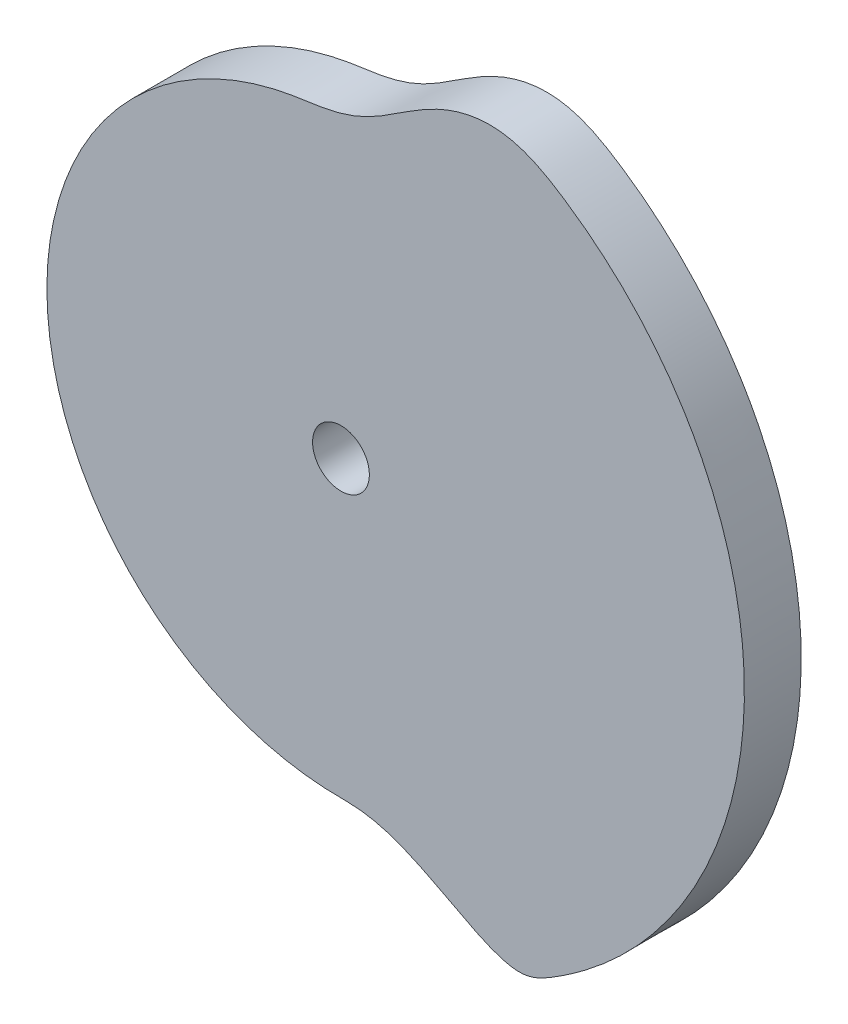
from build123d import *

# Parameters (mm, degrees)
EXTRUDE_1_DEPTH     = 20
SKETCH_3_R          = 10
CUT_EXTRUDE_1_DEPTH = 20


with BuildPart() as part:
    # 草图2 → 凸台-拉伸1 (new body)
    with BuildSketch(Plane.XY):
        with BuildLine():
            add(Edge.make_bspline(
                [(120.6409, 74.9228), (120.424491644, 75.271253162), (119.987025383, 75.968711121), (119.321122278, 77.010451791), (118.644596159, 78.048812713), (117.95902515, 79.08120058), (117.264349113, 80.107516561), (116.560918235, 81.127821325), (115.848463484, 82.141875173), (115.127135969, 83.149607476), (114.397261787, 84.15119926), (113.658547071, 85.146290185), (112.91113699, 86.13485764), (112.155219415, 87.116929117), (111.390710021, 88.092322615), (110.617708202, 89.061021481), (109.836281751, 90.02296082), (109.046499787, 90.978014766), (108.248479663, 91.926187723), (107.442137758, 92.867285497), (106.627672518, 93.801382472), (105.805035306, 94.728312903), (104.974339947, 95.648017536), (104.135636049, 96.560383125), (103.289071135, 97.465482103), (102.434635925, 98.363146423), (101.572267486, 99.253246828), (100.702307596, 100.135852531), (99.824632858, 101.010811334), (98.939374295, 101.878086521), (98.046535597, 102.737579182), (97.146334041, 103.589348102), (96.238635721, 104.43311522), (95.323570878, 105.268946887), (94.401342388, 106.096822722), (93.471865757, 106.9165788), (92.535282406, 107.728159928), (91.591644379, 108.531547539), (90.641169726, 109.326824782), (89.683640319, 110.113583545), (88.71930387, 110.892012571), (87.748251038, 111.662040731), (86.770355473, 112.423374706), (85.786113587, 113.176470761), (84.795174076, 113.920754444), (83.797764829, 114.656330372), (82.794053348, 115.383260732), (81.784050339, 116.101406075), (80.767696792, 116.810549085), (79.745332856, 117.511018129), (78.716802071, 118.202358007), (77.684613003, 118.883395625), (76.653017798, 119.550902872), (75.625782791, 120.201031454), (74.603872822, 120.830554503), (73.586619262, 121.438667081), (72.572958175, 122.024099165), (71.561999561, 122.585769837), (70.55292245, 123.1229207), (69.544884738, 123.634685536), (68.53686813, 124.120039815), (67.528375595, 124.578816462), (66.518335228, 125.009937131), (65.506083846, 125.413008412), (64.490834361, 125.787601607), (63.471842078, 126.133191003), (62.448327159, 126.449174898), (61.419694057, 126.73534941), (60.385355286, 126.991369432), (59.344684974, 127.216403094), (58.29732369, 127.410482462), (57.242873686, 127.573127971), (56.181092346, 127.703799145), (55.111827958, 127.802125229), (54.035125131, 127.867843024), (52.951079132, 127.900487581), (51.859972615, 127.899891561), (50.76222517, 127.865999284), (49.658408678, 127.798058415), (48.54917794, 127.696732555), (47.435331722, 127.561398714), (46.317738848, 127.392729508), (45.197445982, 127.190497265), (44.075418826, 126.955471198), (42.95279176, 126.687943953), (41.830772274, 126.388443588), (40.71042266, 126.058009772), (39.592907794, 125.697355651), (38.479251351, 125.307628523), (37.370563758, 124.889877701), (36.267753196, 124.445490131), (35.171826674, 123.975577346), (34.083309091, 123.482128916), (33.00307387, 122.966169583), (31.931537491, 122.429506124), (30.868929351, 121.873966938), (29.815549537, 121.301125779), (28.771312385, 120.712840739), (27.736142877, 120.110768316), (26.709730739, 119.496620565), (25.691342823, 118.872541261), (24.680577714, 118.239837179), (23.676270422, 117.60054452), (22.677557518, 116.95627162), (21.683055234, 116.308909767), (20.691654753, 115.659921727), (19.701643253, 115.011306861), (18.711711778, 114.364443525), (17.720156292, 113.721261438), (16.725303592, 113.083524634), (15.725581844, 112.453029714), (14.719568632, 111.831558346), (13.705762259, 111.221129856), (12.683079376, 110.623682527), (11.6506221, 110.04098993), (10.607593363, 109.475496889), (9.553866502, 108.928897174), (8.489494478, 108.403285947), (7.415065362, 107.900271443), (6.331393606, 107.421598385), (5.239802657, 106.968399135), (4.141791836, 106.541813064), (3.039231258, 106.142219279), (1.934038816, 105.769985071), (0.828229923, 105.424902541), (-0.276080933, 105.106107748), (-1.377085582, 104.812768364), (-2.472843884, 104.543340058), (-3.561741763, 104.296290192), (-4.642243091, 104.06995509), (-5.713006031, 103.861934663), (-6.772903126, 103.670248938), (-7.820877185, 103.492803552), (-8.855980589, 103.327312827), (-9.877336984, 103.171685571), (-10.884169037, 103.023645404), (-11.87563122, 102.881019759), (-12.850963337, 102.742276536), (-13.809212945, 102.604942503), (-14.749601761, 102.467757589), (-15.671168958, 102.328673645), (-16.57629173, 102.185952568), (-17.470623157, 102.0367669), (-18.360405304, 101.880515445), (-19.248772566, 101.716404218), (-20.13564812, 101.544440333), (-21.021048463, 101.365031996), (-21.904796436, 101.177665093), (-22.786900748, 100.982678239), (-23.667276148, 100.780005131), (-24.545821381, 100.569541913), (-25.422515028, 100.351608438), (-26.297257766, 100.12583966), (-27.170007245, 99.892592762), (-28.040697517, 99.651647908), (-28.909224533, 99.403153155), (-29.775625473, 99.147191522), (-30.639645448, 98.883429117), (-31.501398295, 98.612352437), (-32.360749974, 98.333764474), (-33.217615572, 98.047519299), (-34.071997105, 97.753955472), (-34.923772353, 97.452936638), (-35.772836983, 97.144453649), (-36.619169957, 96.82848923), (-37.462777389, 96.505353739), (-38.30348451, 96.174709858), (-39.141314725, 95.836794663), (-39.976180164, 95.491661247), (-40.807926887, 95.139059868), (-41.636647526, 94.779441059), (-42.46211951, 94.412360002), (-43.28443952, 94.038334765), (-44.103407036, 93.656953744), (-44.919011076, 93.268519186), (-45.73122035, 92.872927633), (-46.539980013, 92.470435974), (-47.345089439, 92.060614341), (-48.146712262, 91.644080784), (-48.94462083, 91.220484028), (-49.738739178, 90.789817959), (-50.529144727, 90.352377143), (-51.315649831, 89.907891412), (-52.098367795, 89.456793432), (-52.876952735, 88.998608541), (-53.651583059, 88.533794908), (-54.422212961, 88.062352462), (-55.18857334, 87.583990303), (-55.950826305, 87.099128779), (-56.708723427, 86.607493212), (-57.462325514, 86.109268511), (-58.211621817, 85.604601327), (-58.956484078, 85.093396256), (-59.696704612, 84.57557028), (-60.432514053, 84.051451962), (-61.163653329, 83.520867802), (-61.890179062, 82.983945609), (-62.61204334, 82.440739775), (-63.329046631, 81.891144381), (-64.041349598, 81.335453387), (-64.748602189, 80.773404637), (-65.451035593, 80.205333037), (-66.148419235, 79.631092769), (-66.840871801, 79.050908786), (-67.528161538, 78.464614647), (-68.210257816, 77.872253469), (-68.887282692, 77.274105354), (-69.558964677, 76.669966936), (-70.225394501, 76.060085059), (-70.886420603, 75.444326452), (-71.542075219, 74.822866328), (-72.192335206, 74.19574541), (-72.837021284, 73.562915433), (-73.476247064, 72.924526123), (-74.109836969, 72.280533369), (-74.737732728, 71.631014726), (-75.359954504, 70.976088579), (-75.976480968, 70.315797143), (-76.587168498, 69.650072213), (-77.192067873, 68.979089065), (-77.791083449, 68.302857213), (-78.384212585, 67.621465693), (-78.971299121, 66.934841874), (-79.552398543, 66.243158006), (-80.127449529, 65.546394454), (-80.696379974, 64.844648429), (-81.259271304, 64.138010166), (-81.815796066, 63.426433309), (-82.366183043, 62.710064654), (-82.910242858, 61.988883007), (-83.4480472, 61.263001612), (-83.979482382, 60.532427296), (-84.504567771, 59.797288746), (-85.023143755, 59.057563535), (-85.535342114, 58.313422249), (-86.040845555, 57.564715903), (-86.540049346, 56.811753825), (-87.032353612, 56.054273907), (-87.518336475, 55.292750342), (-87.99741782, 54.526855333), (-88.469882689, 53.756882285), (-88.935806824, 52.982888952), (-89.39455478, 52.204653291), (-89.846880018, 51.422659011), (-90.292164182, 50.636642103), (-90.730495972, 49.846714448), (-91.162217922, 49.053162123), (-91.586623663, 48.255652742), (-92.004388931, 47.454634351), (-92.41496606, 46.649916188), (-92.818465649, 45.841661442), (-93.215009309, 45.029960729), (-93.604359954, 44.214765855), (-93.986708352, 43.396266158), (-94.361790125, 42.574404793), (-94.729797784, 41.749367284), (-95.090536679, 40.921112368), (-95.443888237, 40.089706841), (-95.790103363, 39.255276993), (-96.129128923, 38.417910625), (-96.460742048, 37.577577926), (-96.7849133, 36.734350598), (-97.101825611, 35.888364913), (-97.41136101, 35.03965274), (-97.713329519, 34.188226244), (-98.007927599, 33.334223249), (-98.295151321, 32.477706483), (-98.574876711, 31.618721887), (-98.846927767, 30.757249485), (-99.111664487, 29.893512443), (-99.368761821, 29.027475226), (-99.618271779, 28.159242254), (-99.860183021, 27.28884247), (-100.094407886, 26.416345572), (-100.321350782, 25.541906032), (-100.540241135, 24.665425405), (-100.751659446, 23.787095867), (-100.955513949, 22.907021367), (-101.151460201, 22.025125963), (-101.339902065, 21.141614206), (-101.520486179, 20.256435191), (-101.69336926, 19.369764188), (-101.858617162, 18.481610876), (-102.01599017, 17.592037407), (-102.165610823, 16.701105737), (-102.30737402, 15.808893366), (-102.441496244, 14.915500993), (-102.567830439, 14.020975092), (-102.686182442, 13.125396071), (-102.796819275, 12.228799489), (-102.899577679, 11.331293825), (-102.994639575, 10.432902461), (-103.081681111, 9.533725625), (-103.161035713, 8.633798881), (-103.232380716, 7.733224067), (-103.29602957, 6.832062336), (-103.351709809, 5.930392903), (-103.399525951, 5.028259015), (-103.439387105, 4.125755015), (-103.471525472, 3.222923514), (-103.495714092, 2.319855105), (-103.51201456, 1.416620728), (-103.520427137, 0.513286022), (-103.520877571, -0.390114453), (-103.5136626, -1.293483762), (-103.498274495, -2.196749103), (-103.475236409, -3.099852243), (-103.444177876, -4.002716524), (-103.405459397, -4.905290952), (-103.358578231, -5.807451426), (-103.304034091, -6.709190954), (-103.24148294, -7.610419605), (-103.171222296, -8.511092641), (-103.093037465, -9.411096242), (-103.006843618, -10.310347785), (-102.9131718, -11.208873106), (-102.811252368, -12.106516504), (-102.701841347, -13.003269647), (-102.584383521, -13.89899303), (-102.45921027, -14.793664536), (-102.326197334, -15.687197538), (-102.185402039, -16.579533268), (-102.036769479, -17.470623438), (-101.880514754, -18.360405229), (-101.716404403, -19.248772586), (-101.544440283, -20.135648115), (-101.36503201, -21.021048464), (-101.177665089, -21.904796435), (-100.98267824, -22.786900748), (-100.780005131, -23.667276148), (-100.569541913, -24.545821381), (-100.351608438, -25.422515028), (-100.12583966, -26.297257766), (-99.892592762, -27.170007245), (-99.651647908, -28.040697517), (-99.403153155, -28.909224533), (-99.147191522, -29.775625473), (-98.883429117, -30.639645448), (-98.612352437, -31.501398295), (-98.333764474, -32.360749974), (-98.047519299, -33.217615572), (-97.753955472, -34.071997105), (-97.452936638, -34.923772353), (-97.144453649, -35.772836983), (-96.82848923, -36.619169957), (-96.505353739, -37.462777389), (-96.174709858, -38.30348451), (-95.836794663, -39.141314725), (-95.491661247, -39.976180164), (-95.139059868, -40.807926887), (-94.779441059, -41.636647526), (-94.412360002, -42.46211951), (-94.038334765, -43.28443952), (-93.656953744, -44.103407036), (-93.268519186, -44.919011076), (-92.872927633, -45.73122035), (-92.470435974, -46.539980013), (-92.060614341, -47.345089439), (-91.644080784, -48.146712262), (-91.220484028, -48.94462083), (-90.789817959, -49.738739178), (-90.352377143, -50.529144727), (-89.907891412, -51.315649831), (-89.456793432, -52.098367795), (-88.998608541, -52.876952735), (-88.533794908, -53.651583059), (-88.062352462, -54.422212961), (-87.583990303, -55.18857334), (-87.099128779, -55.950826305), (-86.607493212, -56.708723427), (-86.109268511, -57.462325514), (-85.604601327, -58.211621817), (-85.093396256, -58.956484078), (-84.57557028, -59.696704612), (-84.051451962, -60.432514053), (-83.520867802, -61.163653329), (-82.983945609, -61.890179062), (-82.440739775, -62.61204334), (-81.891144381, -63.329046631), (-81.335453387, -64.041349598), (-80.773404637, -64.748602189), (-80.205333037, -65.451035593), (-79.631092769, -66.148419235), (-79.050908786, -66.840871801), (-78.464614647, -67.528161538), (-77.872253469, -68.210257816), (-77.274105354, -68.887282692), (-76.669966936, -69.558964677), (-76.060085059, -70.225394501), (-75.444326452, -70.886420603), (-74.822866328, -71.542075219), (-74.19574541, -72.192335206), (-73.562915433, -72.837021284), (-72.924526123, -73.476247064), (-72.280533369, -74.109836969), (-71.631014726, -74.737732728), (-70.976088579, -75.359954504), (-70.315797143, -75.976480968), (-69.650072213, -76.587168498), (-68.979089065, -77.192067873), (-68.302857213, -77.791083449), (-67.621465693, -78.384212585), (-66.934841874, -78.971299121), (-66.243158006, -79.552398543), (-65.546394454, -80.127449529), (-64.844648429, -80.696379974), (-64.138010166, -81.259271304), (-63.426433309, -81.815796066), (-62.710064654, -82.366183043), (-61.988883007, -82.910242858), (-61.263001612, -83.4480472), (-60.532427296, -83.979482382), (-59.797288746, -84.504567771), (-59.057563535, -85.023143755), (-58.313422249, -85.535342114), (-57.564715903, -86.040845555), (-56.811753825, -86.540049346), (-56.054273907, -87.032353612), (-55.292750342, -87.518336475), (-54.526855333, -87.99741782), (-53.756882285, -88.469882689), (-52.982888952, -88.935806824), (-52.204653291, -89.39455478), (-51.422659011, -89.846880018), (-50.636642103, -90.292164182), (-49.846714448, -90.730495972), (-49.053162123, -91.162217922), (-48.255652742, -91.586623663), (-47.454634351, -92.004388931), (-46.649916188, -92.41496606), (-45.841661442, -92.818465649), (-45.029960729, -93.215009309), (-44.214765855, -93.604359954), (-43.396266158, -93.986708352), (-42.574404793, -94.361790125), (-41.749367284, -94.729797784), (-40.921112368, -95.090536679), (-40.089706841, -95.443888237), (-39.255276993, -95.790103363), (-38.417910625, -96.129128923), (-37.577577926, -96.460742048), (-36.734350598, -96.7849133), (-35.888364913, -97.101825611), (-35.03965274, -97.41136101), (-34.188226244, -97.713329519), (-33.334223249, -98.007927599), (-32.477706483, -98.295151321), (-31.618721887, -98.574876711), (-30.757249485, -98.846927767), (-29.893512443, -99.111664487), (-29.027475226, -99.368761821), (-28.159242254, -99.618271779), (-27.28884247, -99.860183021), (-26.416345572, -100.094407886), (-25.541906032, -100.321350782), (-24.665425405, -100.540241135), (-23.787095867, -100.751659446), (-22.907021367, -100.955513949), (-22.025125963, -101.151460201), (-21.141614206, -101.339902065), (-20.256435191, -101.520486179), (-19.369764188, -101.69336926), (-18.481610876, -101.858617162), (-17.592037407, -102.01599017), (-16.701105737, -102.165610823), (-15.808893366, -102.30737402), (-14.915500993, -102.441496244), (-14.020975092, -102.567830439), (-13.125396071, -102.686182442), (-12.228799489, -102.796819275), (-11.331293825, -102.899577679), (-10.432902461, -102.994639575), (-9.533725625, -103.081681111), (-8.633798881, -103.161035713), (-7.733224067, -103.232380716), (-6.832062335, -103.29602957), (-5.930392905, -103.351709807), (-5.028259007, -103.399525958), (-4.125755044, -103.439387079), (-3.222923409, -103.471525567), (-2.319788866, -103.495715521), (-1.405150595, -103.512222578), (-0.456406908, -103.520875998), (0.54905491, -103.528252427), (1.622163909, -103.54085635), (2.761350056, -103.566087551), (3.963382766, -103.612131975), (5.223690223, -103.686432441), (6.536603571, -103.796227305), (7.895779989, -103.947992278), (9.294748702, -104.146174913), (10.727233992, -104.394687904), (12.187886562, -104.695164427), (13.672167772, -105.048828152), (15.176778809, -105.455122458), (16.699242686, -105.913454993), (18.23815877, -106.422067087), (19.792540448, -106.979304502), (21.361821663, -107.58299346), (22.945579427, -108.230442758), (24.543258829, -108.91892615), (26.154028298, -109.645212552), (27.776541232, -110.406101608), (29.409414301, -111.197248645), (31.050486831, -112.014580426), (32.697261397, -112.853271038), (34.346796519, -113.708151348), (35.995937881, -114.573266469), (37.640924143, -115.443106468), (39.277932922, -116.311085729), (40.902932078, -117.170599291), (42.511437603, -118.015035764), (44.099185033, -118.837467148), (45.661602062, -119.631174133), (47.194264219, -120.389344747), (48.69243131, -121.10593065), (50.151649024, -121.7750668), (51.567711177, -122.391148586), (52.936264615, -122.950201334), (54.253583756, -123.448404235), (55.516336238, -123.883447921), (56.721838339, -124.254215941), (57.868494215, -124.560531943), (58.955720542, -124.804160301), (59.984715006, -124.987134211), (60.958277943, -125.112570797), (61.881012249, -125.184652236), (62.759457157, -125.206404854), (63.601678642, -125.181409946), (64.416911647, -125.111756615), (65.21500676, -124.998848228), (66.005622242, -124.842165588), (66.797936737, -124.641163889), (67.599983666, -124.394064432), (68.418401746, -124.098749126), (69.258502296, -123.753572551), (70.124371814, -123.357462606), (71.019101562, -122.910126488), (71.945056514, -122.412038523), (72.904534356, -121.865296273), (73.899333807, -121.272435061), (74.924108451, -120.642144242), (75.966311085, -119.988579265), (77.010449535, -119.321118434), (78.048813317, -118.644597189), (79.081200418, -117.959024874), (80.107516605, -117.264349187), (81.127821313, -116.560918216), (82.141875177, -115.848463489), (83.149607475, -115.127135967), (84.15119926, -114.397261788), (85.146290185, -113.65854707), (86.13485764, -112.91113699), (87.116929117, -112.155219415), (88.092322615, -111.390710021), (89.061021481, -110.617708202), (90.02296082, -109.836281751), (90.978014766, -109.046499787), (91.926187723, -108.248479663), (92.867285497, -107.442137758), (93.801382472, -106.627672518), (94.728312903, -105.805035306), (95.648017536, -104.974339947), (96.560383125, -104.135636049), (97.465482103, -103.289071135), (98.363146423, -102.434635925), (99.253246828, -101.572267486), (100.135852531, -100.702307596), (101.010811334, -99.824632858), (101.878086521, -98.939374295), (102.737579182, -98.046535597), (103.589348102, -97.146334041), (104.43311522, -96.238635721), (105.268946887, -95.323570878), (106.096822722, -94.401342388), (106.9165788, -93.471865757), (107.728159928, -92.535282406), (108.531547539, -91.591644379), (109.326824782, -90.641169726), (110.113583545, -89.683640319), (110.892012571, -88.71930387), (111.662040731, -87.748251038), (112.423374707, -86.770355474), (113.176470758, -85.786113586), (113.920754454, -84.795174083), (114.656330335, -83.797764804), (115.383260872, -82.794053439), (116.101405555, -81.784049996), (116.810551027, -80.767698073), (117.511010884, -79.745328077), (118.20240057, -78.716796812), (118.8847958, -77.682271159), (119.558222817, -76.641908702), (120.222424187, -75.595632333), (120.877551892, -74.543648038), (121.523398157, -73.485927349), (122.160197639, -72.422738205), (122.787428996, -71.353889812), (123.405492736, -70.279691553), (124.014039759, -69.200074372), (124.613302973, -68.115292296), (125.202911256, -67.025223867), (125.782945843, -65.930037005), (126.353647945, -64.829937916), (126.914470494, -63.724795337), (127.465852214, -62.614916422), (128.007310178, -61.500160109), (128.539141179, -60.380772117), (129.061127279, -59.256746923), (129.573344513, -58.128251621), (130.075666447, -56.995309298), (130.568033704, -55.858010729), (131.050579408, -54.716493092), (131.523068003, -53.570770373), (131.985560431, -52.420996809), (132.438014377, -51.26723324), (132.88024373, -50.109510371), (133.312634042, -48.948064033), (133.734560515, -47.782795932), (134.146514639, -46.613977613), (134.548222271, -45.441574532), (134.939609169, -44.265686666), (135.320694022, -43.086422055), (135.69164115, -41.903941889), (136.052137326, -40.718223822), (136.402201895, -39.529388263), (136.742059509, -38.33760805), (137.071341799, -37.142844348), (137.390216148, -35.945256264), (137.69878233, -34.744974564), (137.996617105, -33.541993265), (138.284183661, -32.336510246), (138.561058742, -31.128521853), (138.827345124, -29.918163612), (139.083173898, -28.705562116), (139.328367999, -27.490745908), (139.56295893, -26.273829853), (139.786997563, -25.054928066), (140.00024355, -23.834098499), (140.203023167, -22.611507907), (140.39485261, -21.387138301), (140.576192301, -20.161168693), (140.746769137, -18.933651298), (140.906719186, -17.704714219), (141.055762856, -16.474422403), (141.194219032, -15.242884964), (141.321769035, -14.010162236), (141.438712632, -12.776388957), (141.544769468, -11.541601923), (141.640229018, -10.30596433), (141.724702177, -9.069511895), (141.798359735, -7.832427757), (141.861448943, -6.59475481), (141.913452989, -5.356567445), (141.954940991, -4.117925673), (141.985387695, -2.878975655), (142.005103708, -1.639795755), (142.013998563, -0.400548564), (142.012101276, 0.838765169), (141.999394635, 2.07797874), (141.975923493, 3.317094113), (141.941505279, 4.555907218), (141.896264978, 5.79438423), (141.840432566, 7.032404119), (141.773599019, 8.269915329), (141.695968238, 9.506791038), (141.607737199, 10.742981719), (141.508465076, 11.978318125), (141.398617309, 13.212772848), (141.277866665, 14.446178625), (141.146517167, 15.678501668), (141.004265646, 16.909606043), (140.851425299, 18.139432152), (140.687633935, 19.367858431), (140.513421509, 20.594860981), (140.328284823, 21.820265885), (140.132450515, 23.044002167), (139.92610128, 24.26599751), (139.708957524, 25.486131995), (139.481255558, 26.704345542), (139.243009107, 27.920544688), (138.99393061, 29.134563234), (138.734470287, 30.346393126), (138.464378035, 31.555910835), (138.18361069, 32.762994065), (137.892595114, 33.967645837), (137.59080091, 35.169654288), (137.278777375, 36.369031119), (136.956146522, 37.565606185), (136.622996665, 38.759288722), (136.279650837, 39.95009592), (135.925826103, 41.137838368), (135.561617137, 42.322441509), (135.187101686, 43.503808092), (134.802450156, 44.681895881), (134.407268318, 45.856496103), (134.002016633, 47.027695649), (133.586477605, 48.195286377), (133.160919152, 49.359230752), (132.72506169, 50.519347308), (132.279207826, 51.675649139), (131.823132684, 52.82799017), (131.357191608, 53.976364561), (130.881161767, 55.120603756), (130.395148685, 56.260649712), (129.899165204, 57.396379439), (129.393318608, 58.527742903), (128.877742537, 59.654687565), (128.352228772, 60.777085004), (127.816914824, 61.894831324), (127.272038529, 63.00792822), (126.717288869, 64.116140244), (126.15292268, 65.21947613), (125.578961934, 66.317881334), (124.995502626, 67.411238642), (124.40247459, 68.499477269), (123.799995839, 69.582458149), (123.188040735, 70.660114411), (122.566750745, 71.732441389), (121.936055354, 72.799292987), (121.294623255, 73.863114865), (120.860376724, 74.56940626), (120.6409, 74.9228)],
                knots=[0, 0, 0, 0, 0.001586047, 0.003183391, 0.004780636, 0.006377974, 0.007975241, 0.009572593, 0.011169833, 0.01276719, 0.014364455, 0.015961795, 0.017559153, 0.019156393, 0.020753715, 0.022351058, 0.023948365, 0.025545756, 0.02714299, 0.028740272, 0.030337639, 0.031934933, 0.033532278, 0.035129613, 0.036726789, 0.038324199, 0.039921507, 0.041518837, 0.043116037, 0.04471341, 0.046310714, 0.047907977, 0.049505325, 0.051102606, 0.052700026, 0.054297257, 0.055894604, 0.057491908, 0.059089192, 0.06068651, 0.062283788, 0.063881145, 0.065478444, 0.06707576, 0.068673082, 0.070270428, 0.071867714, 0.073464984, 0.075062287, 0.076659607, 0.078256918, 0.079854129, 0.081441144, 0.083007906, 0.084554666, 0.086081985, 0.087590377, 0.08908069, 0.090553596, 0.092010264, 0.093451681, 0.094879214, 0.096293939, 0.097697651, 0.099091706, 0.10047779, 0.101857682, 0.103233071, 0.104605678, 0.105977233, 0.107349394, 0.108723807, 0.110102023, 0.111485274, 0.112875088, 0.114272364, 0.115678156, 0.117093387, 0.118518351, 0.11995368, 0.121399639, 0.122856274, 0.124323375, 0.125800861, 0.127288375, 0.128785202, 0.130290719, 0.13180439, 0.133325246, 0.134852484, 0.136385131, 0.137922249, 0.139462842, 0.141006031, 0.142550864, 0.144096464, 0.145642202, 0.14718706, 0.148730683, 0.150272502, 0.151811953, 0.153348951, 0.154883292, 0.156415249, 0.157944438, 0.159471624, 0.160996981, 0.162520889, 0.164044104, 0.165566946, 0.167090142, 0.168614198, 0.170139173, 0.171665825, 0.173193764, 0.174723057, 0.17625324, 0.177783453, 0.179312778, 0.180840104, 0.182363851, 0.183882519, 0.185394507, 0.186898046, 0.188391417, 0.189873305, 0.191342086, 0.19279685, 0.194236187, 0.195659281, 0.197065294, 0.198453748, 0.199823933, 0.201175069, 0.202506935, 0.203818737, 0.205110003, 0.206380051, 0.207627989, 0.208853095, 0.210054702, 0.211231719, 0.212396108, 0.213560521, 0.214724814, 0.215889204, 0.217053602, 0.218217896, 0.219382275, 0.2205467, 0.221711011, 0.22287539, 0.224039708, 0.225204146, 0.226368419, 0.227532863, 0.22869716, 0.229861597, 0.231025901, 0.232190201, 0.233354624, 0.234519056, 0.23568334, 0.236847731, 0.238012032, 0.239176406, 0.240340747, 0.241505096, 0.242669543, 0.243833819, 0.244998199, 0.246162587, 0.247326967, 0.248491247, 0.249655749, 0.250819986, 0.251984449, 0.253148766, 0.254313139, 0.255477486, 0.256641783, 0.257806171, 0.258970512, 0.260134945, 0.261299286, 0.262463606, 0.263627993, 0.264792382, 0.265956725, 0.267121073, 0.268285445, 0.269449857, 0.270614184, 0.271778587, 0.27294283, 0.274107255, 0.275271589, 0.276435922, 0.277600419, 0.278764731, 0.279929103, 0.281093466, 0.282257807, 0.283422131, 0.284586512, 0.285750858, 0.28691527, 0.288079643, 0.289243979, 0.290408274, 0.291572709, 0.292737008, 0.293901349, 0.295065732, 0.296230153, 0.297394519, 0.298558827, 0.299723165, 0.300887533, 0.302051926, 0.303216248, 0.30438059, 0.305544954, 0.306709333, 0.307873633, 0.309038125, 0.310202434, 0.31136685, 0.312531079, 0.313695492, 0.314859895, 0.316024195, 0.317188662, 0.318353023, 0.319517263, 0.320681683, 0.32184605, 0.323010419, 0.324174803, 0.325339083, 0.326503483, 0.327667805, 0.328832225, 0.32999652, 0.331160872, 0.332325258, 0.333489604, 0.334653927, 0.335818383, 0.336982768, 0.338147056, 0.339311394, 0.340475814, 0.341640171, 0.3428045, 0.343968941, 0.345133244, 0.346297617, 0.347461962, 0.348626364, 0.349790698, 0.350955053, 0.352119442, 0.35328379, 0.35444814, 0.355612504, 0.356776847, 0.357941217, 0.35910554, 0.360269984, 0.361434313, 0.362598617, 0.363762986, 0.364927384, 0.366091682, 0.367256123, 0.368420484, 0.369584852, 0.370749132, 0.371913595, 0.373077897, 0.374242279, 0.375406577, 0.376570982, 0.37773533, 0.378899711, 0.380064104, 0.381228452, 0.382392825, 0.383557074, 0.384721544, 0.38588581, 0.387050204, 0.38821457, 0.389378986, 0.390543294, 0.391707701, 0.392872039, 0.394036398, 0.395200743, 0.396365157, 0.397529471, 0.398693776, 0.399858159, 0.401022579, 0.402186871, 0.403351248, 0.404515672, 0.40567997, 0.406844369, 0.40800869, 0.409173027, 0.41033746, 0.411501831, 0.412666102, 0.413830462, 0.414994914, 0.416159247, 0.41732358, 0.418487985, 0.419652296, 0.420816602, 0.421980992, 0.423145405, 0.424309698, 0.425474087, 0.426638486, 0.42780278, 0.428967158, 0.430131583, 0.431295894, 0.432460274, 0.433624591, 0.434789029, 0.435953302, 0.437117747, 0.438282044, 0.43944648, 0.440610785, 0.441775084, 0.442939507, 0.444103939, 0.445268224, 0.446432615, 0.447596915, 0.448761289, 0.44992563, 0.45108998, 0.452254426, 0.453418702, 0.454583082, 0.45574747, 0.456911851, 0.45807613, 0.459240632, 0.460404869, 0.461569332, 0.46273365, 0.463898023, 0.46506237, 0.466226667, 0.467391054, 0.468555396, 0.469719828, 0.470884169, 0.47204849, 0.473212876, 0.474377265, 0.475541609, 0.476705957, 0.477870329, 0.479034741, 0.480199067, 0.481363471, 0.482527714, 0.483692138, 0.484856472, 0.486020805, 0.487185303, 0.488349614, 0.489513987, 0.490678349, 0.49184269, 0.493007014, 0.494171395, 0.495335741, 0.496500153, 0.497664526, 0.498828863, 0.499993157, 0.501157592, 0.502321891, 0.503486233, 0.504650615, 0.505815036, 0.506979403, 0.508143711, 0.509308048, 0.510472417, 0.511636809, 0.512801132, 0.513965473, 0.515129838, 0.516294217, 0.517458517, 0.518623009, 0.519787317, 0.520951733, 0.522115962, 0.523280375, 0.524444778, 0.525609078, 0.526773545, 0.527937907, 0.529102147, 0.530266566, 0.531430933, 0.532595303, 0.533759687, 0.534923966, 0.536088366, 0.537252688, 0.538417108, 0.539581404, 0.540745755, 0.541910142, 0.543074487, 0.54423881, 0.545403266, 0.546567651, 0.54773194, 0.548896278, 0.550060698, 0.551225055, 0.552389383, 0.553553825, 0.554718128, 0.5558825, 0.557046845, 0.558211248, 0.559375581, 0.560539936, 0.561704326, 0.562868673, 0.564033024, 0.565197387, 0.566361731, 0.5675261, 0.568690424, 0.569854867, 0.571019196, 0.572183501, 0.573347869, 0.574512267, 0.575676566, 0.576841007, 0.578005368, 0.579169735, 0.580334015, 0.581498478, 0.58266278, 0.583827163, 0.584991461, 0.586155866, 0.587320214, 0.588484594, 0.589648988, 0.590813335, 0.591977708, 0.593141957, 0.594306427, 0.595470693, 0.596635087, 0.597799453, 0.59896387, 0.600128177, 0.601292584, 0.602456922, 0.603621281, 0.604785626, 0.60595004, 0.607114613, 0.608322753, 0.609618648, 0.611002511, 0.612472362, 0.614024455, 0.615653518, 0.617353599, 0.619118186, 0.620940934, 0.622816113, 0.624738952, 0.626706125, 0.628715089, 0.630764302, 0.632853172, 0.634981435, 0.63714851, 0.639354044, 0.641596825, 0.643875037, 0.646185923, 0.648525931, 0.65089071, 0.65327474, 0.65567163, 0.658074545, 0.660475545, 0.662866747, 0.665239041, 0.667583678, 0.669891265, 0.672153018, 0.674359766, 0.676502859, 0.678574255, 0.680566684, 0.682473624, 0.684289929, 0.686011712, 0.687637064, 0.689165673, 0.690599766, 0.691943968, 0.693205421, 0.694393815, 0.695521148, 0.696601472, 0.697650197, 0.69868325, 0.699716584, 0.700765179, 0.701842518, 0.70296038, 0.704128283, 0.705353413, 0.706641284, 0.707995539, 0.709418408, 0.710910989, 0.712473177, 0.714070276, 0.71566762, 0.717264866, 0.718862203, 0.72045947, 0.722056822, 0.723654062, 0.72525142, 0.726848684, 0.728446024, 0.730043383, 0.731640622, 0.733237944, 0.734835287, 0.736432594, 0.738029985, 0.739627219, 0.741224501, 0.742821868, 0.744419162, 0.746016507, 0.747613842, 0.749211019, 0.750808428, 0.752405736, 0.754003066, 0.755600266, 0.757197639, 0.758794943, 0.760392206, 0.761989554, 0.763586835, 0.765184255, 0.766781486, 0.768378833, 0.769976137, 0.771573421, 0.773170739, 0.774768017, 0.776365374, 0.777962674, 0.77955999, 0.781157311, 0.782754657, 0.784351943, 0.785949214, 0.787546517, 0.789143836, 0.790741147, 0.792338466, 0.793935805, 0.795533038, 0.797130357, 0.798727704, 0.800324982, 0.801922289, 0.803519592, 0.805116947, 0.80671425, 0.8083115, 0.80990888, 0.81150617, 0.813103486, 0.814700778, 0.816298054, 0.817895376, 0.819492695, 0.821090014, 0.822687284, 0.824284628, 0.82588193, 0.827479262, 0.829076625, 0.830673855, 0.832271193, 0.833868567, 0.835465841, 0.837063105, 0.838660436, 0.840257793, 0.841855054, 0.84345238, 0.84504969, 0.846646985, 0.848244299, 0.849841559, 0.85143892, 0.853036256, 0.854633498, 0.85623083, 0.857828189, 0.859425446, 0.86102275, 0.862620069, 0.864217399, 0.865814735, 0.867412048, 0.869009355, 0.870606609, 0.872203972, 0.873801291, 0.875398559, 0.876995882, 0.878593142, 0.880190445, 0.881787799, 0.883385056, 0.884982476, 0.886579776, 0.888177088, 0.889774283, 0.891371599, 0.892968909, 0.894566327, 0.896163591, 0.897760953, 0.899358147, 0.900955552, 0.902552773, 0.904150194, 0.905747417, 0.907344688, 0.908942011, 0.910539373, 0.912136629, 0.913734048, 0.915331347, 0.916928657, 0.918525959, 0.920123261, 0.921720541, 0.92331781, 0.924915154, 0.926512476, 0.928109753, 0.929707084, 0.931304359, 0.932901677, 0.934499031, 0.936096317, 0.937693604, 0.939290914, 0.940888245, 0.942485532, 0.944082833, 0.945680207, 0.947277434, 0.94887476, 0.950472114, 0.952069404, 0.953666753, 0.955264122, 0.956861346, 0.958458627, 0.960056007, 0.961653362, 0.963250648, 0.964847911, 0.966445228, 0.968042479, 0.969639859, 0.971237131, 0.972834416, 0.974431837, 0.976029059, 0.977626318, 0.979223674, 0.980821077, 0.982418305, 0.984015592, 0.985613003, 0.987210199, 0.988807588, 0.99040489, 0.992002227, 0.993599433, 0.995196741, 0.996794163, 0.998391465, 1, 1, 1, 1], degree=3))
        make_face()
    extrude(amount=EXTRUDE_1_DEPTH)

    # 草图3 → 切除-拉伸1 (cut)
    with BuildSketch(Plane.XY):
        Circle(SKETCH_3_R)
    extrude(amount=CUT_EXTRUDE_1_DEPTH, mode=Mode.SUBTRACT)


solid = part.part
